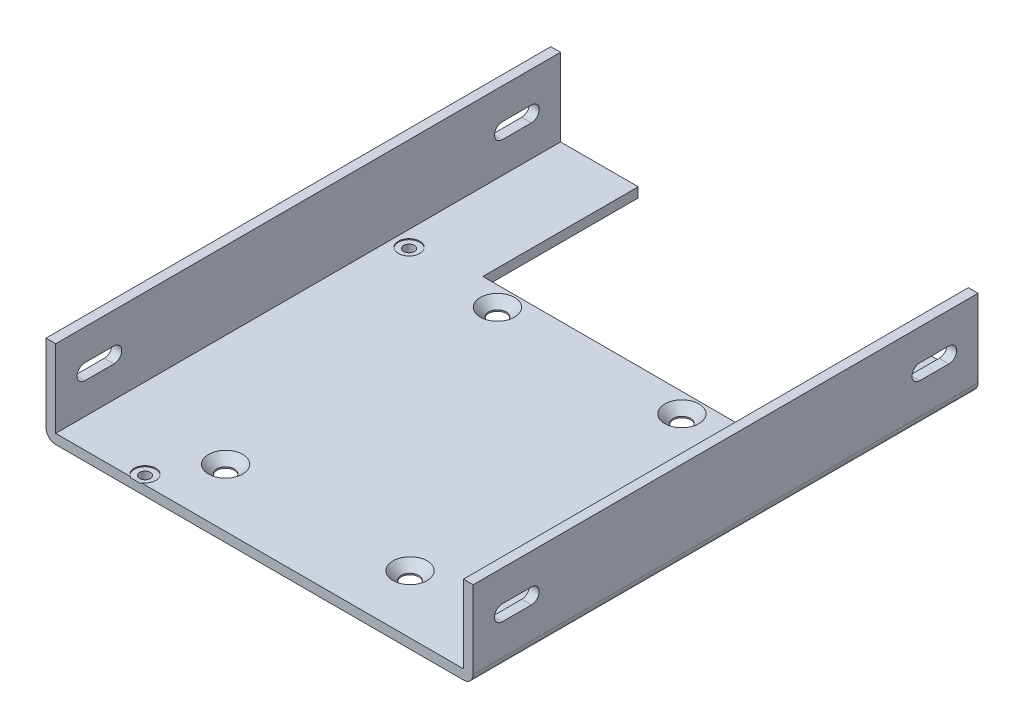
from build123d import *

# Parameters (mm, degrees)
EXTRUDE_1_DEPTH              = 5
HOLE_WIZARD_M8_2_AT_2_COUNT  = 2
HOLE_WIZARD_M8_2_AT_2_PITCH  = 140
HOLE_WIZARD_M8_2_AT_3_COUNT  = 2
HOLE_WIZARD_M8_2_AT_3_PITCH  = 169.189243157
HOLE_WIZARD_M8_2_AT_4_COUNT  = 2
HOLE_WIZARD_M8_2_AT_4_PITCH  = 95
SKETCH_10_W                  = 5
SKETCH_10_H                  = 45
EXTRUDE_2_DEPTH              = 260
FILLET_1_R                   = 5
CUT_EXTRUDE_5_DEPTH          = 344.547667726
HOLE_WIZARD_M5_1_D           = 5.5
HOLE_WIZARD_M5_1_CBORE_D     = 11
HOLE_WIZARD_M5_1_CBORE_DEPTH = 0.5


with BuildPart() as part:
    # 草图1 → 凸台-拉伸1 (new body)
    with BuildSketch(Plane(origin=(0, 0, 0), x_dir=(1, 0, 0), z_dir=(0, 1, 0))):
        Polygon((0, 0), (0, -260), (210, -260), (210, 0), (170, 0), (170, -80), (40, -80), (40, 0), align=None)
    extrude(amount=EXTRUDE_1_DEPTH)

    # 草图9 → M8 内六角花形沉头螺钉的锥形沉头孔2 (revolve, cut)
    with BuildSketch(Plane(origin=(57.5, 5, 230), x_dir=(0, 0, 1), z_dir=(1, 0, 0))):
        Polygon((0, 0), (0, 5), (4.5, 5), (4.5, 4.3), (8.8, 0), align=None)
    hole_wizard_m8_2 = revolve(axis=Axis((57.5, 11.35, 230), (0, -1, 0)), mode=Mode.SUBTRACT)

    # M8 内六角花形沉头螺钉的锥形沉头孔2 at 2: M8 内六角花形沉头螺钉的锥形沉头孔2 ×2
    with Locations(*[(0, 0, -i * HOLE_WIZARD_M8_2_AT_2_PITCH) for i in range(1, HOLE_WIZARD_M8_2_AT_2_COUNT)]):
        add(hole_wizard_m8_2, mode=Mode.SUBTRACT)

    # M8 内六角花形沉头螺钉的锥形沉头孔2 at 3: M8 内六角花形沉头螺钉的锥形沉头孔2 ×2
    with Locations(*[Vector(0.5615014183372644, 0, -0.8274757743917585) * (i * HOLE_WIZARD_M8_2_AT_3_PITCH) for i in range(1, HOLE_WIZARD_M8_2_AT_3_COUNT)]):
        add(hole_wizard_m8_2, mode=Mode.SUBTRACT)

    # M8 内六角花形沉头螺钉的锥形沉头孔2 at 4: M8 内六角花形沉头螺钉的锥形沉头孔2 ×2
    with Locations(*[(i * HOLE_WIZARD_M8_2_AT_4_PITCH, 0, 0) for i in range(1, HOLE_WIZARD_M8_2_AT_4_COUNT)]):
        add(hole_wizard_m8_2, mode=Mode.SUBTRACT)

    # 草图10 → 凸台-拉伸2 (add, through all)
    with BuildSketch(Plane(origin=(0, 0, 0), x_dir=(-1, 0, 0), z_dir=(0, 0, -1))):
        with Locations((2.5, 22.5)):
            Rectangle(SKETCH_10_W, SKETCH_10_H)
        with Locations((-212.5, 22.5)):
            Rectangle(SKETCH_10_W, SKETCH_10_H)
    extrude(amount=-EXTRUDE_2_DEPTH)

    # 圆角1
    fillet_1_edges = [part.edges().sort_by_distance(p)[0] for p in [
        (-5, 0, 130),
        (215, 0, 130),
    ]]
    fillet(fillet_1_edges, radius=FILLET_1_R)

    # 草图11 → 切除-拉伸5 (cut, through all)
    with BuildSketch(Plane(origin=(215, 0, 0), x_dir=(0, 0, -1), z_dir=(1, 0, 0))):
        with BuildLine():
            Line((-15, 29), (-30, 29))
            ThreePointArc((-30, 29), (-34, 25), (-30, 21))
            Line((-30, 21), (-15, 21))
            ThreePointArc((-15, 21), (-11, 25), (-15, 29))
        make_face()
        with BuildLine():
            Line((-230, 21), (-245, 21))
            ThreePointArc((-245, 21), (-249, 25), (-245, 29))
            Line((-245, 29), (-230, 29))
            ThreePointArc((-230, 29), (-226, 25), (-230, 21))
        make_face()
    extrude(amount=-CUT_EXTRUDE_5_DEPTH, mode=Mode.SUBTRACT)

    # M5 六角头螺栓的柱形沉头孔1 (through all)
    with Locations(Plane(origin=(0, 5, 0), x_dir=(1, 0, 0), z_dir=(0, 1, 0))):
        with Locations((176.25, -129.5), (8, -86), (41.25, -255.25)):
            CounterBoreHole(HOLE_WIZARD_M5_1_D / 2, HOLE_WIZARD_M5_1_CBORE_D / 2, HOLE_WIZARD_M5_1_CBORE_DEPTH)


solid = part.part
